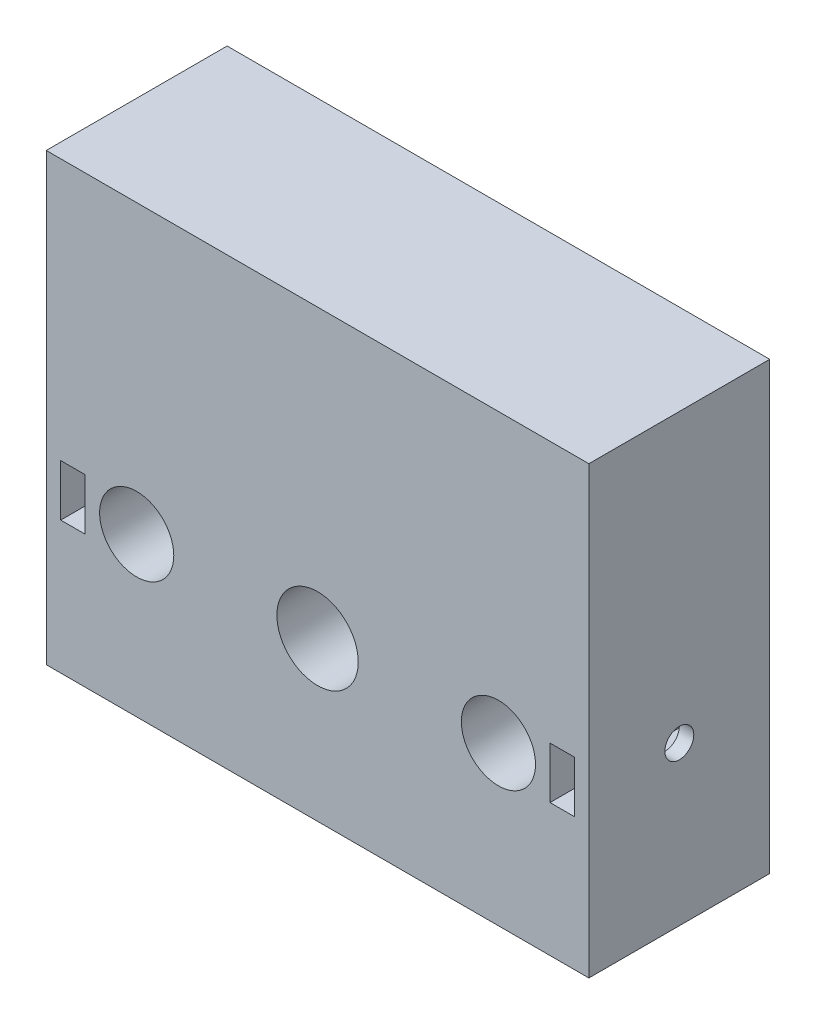
from build123d import *

# Parameters (mm, degrees)
SKETCH_1_W          = 60
SKETCH_1_H          = 35
EXTRUDE_1_DEPTH     = 20
HOLE_WIZARD_356_D   = 9
HOLE_WIZARD_461_D   = 8.2
SKETCH_8_W          = 2.7
SKETCH_8_H          = 5.7
CUT_EXTRUDE_1_DEPTH = 41.078048855
SKETCH_9_R          = 1.6
CUT_EXTRUDE_2_DEPTH = 10
SKETCH_10_W         = 60
SKETCH_10_H         = 20
EXTRUDE_2_DEPTH     = 14.25


with BuildPart() as part:
    # 草图1 → 凸台-拉伸1 (new body)
    with BuildSketch(Plane.XY):
        Rectangle(SKETCH_1_W, SKETCH_1_H)
    extrude(amount=EXTRUDE_1_DEPTH)

    # Hole Wizard 356 (through all)
    with Locations(Plane.XY.offset(20)):
        with Locations((0, 0)):
            Hole(HOLE_WIZARD_356_D / 2)

    # Hole Wizard 461 (through all)
    with Locations(Plane.XY.offset(20)):
        with Locations((20, 0), (-20, 0)):
            Hole(HOLE_WIZARD_461_D / 2)

    # 草图8 → 切除-拉伸1 (cut, through all)
    with BuildSketch(Plane.XY.offset(20)):
        with Locations((27.05, 0)):
            Rectangle(SKETCH_8_W, SKETCH_8_H)
    cut_extrude_1 = extrude(amount=-CUT_EXTRUDE_1_DEPTH, mode=Mode.SUBTRACT)

    # 草图9 → 切除-拉伸2 (cut)
    with BuildSketch(Plane(origin=(30, 0, 0), x_dir=(0, 0, -1), z_dir=(1, 0, 0))):
        with Locations(Location((-10, 0, 0), (0, 0, 180))):
            Circle(SKETCH_9_R)
    cut_extrude_2 = extrude(amount=-CUT_EXTRUDE_2_DEPTH, mode=Mode.SUBTRACT)

    # 镜向1: 切除-拉伸1, 切除-拉伸2 across plane
    add(cut_extrude_1.mirror(Plane(origin=(0, 0, 0), x_dir=(0, 0, 1), z_dir=(1, 0, 0))), mode=Mode.SUBTRACT)
    add(cut_extrude_2.mirror(Plane(origin=(0, 0, 0), x_dir=(0, 0, 1), z_dir=(1, 0, 0))), mode=Mode.SUBTRACT)

    # 草图10 → 凸台-拉伸2 (add)
    with BuildSketch(Plane(origin=(0, 17.5, 0), x_dir=(1, 0, 0), z_dir=(0, 1, 0))):
        with Locations((0, -10)):
            Rectangle(SKETCH_10_W, SKETCH_10_H)
    extrude(amount=EXTRUDE_2_DEPTH)


solid = part.part
